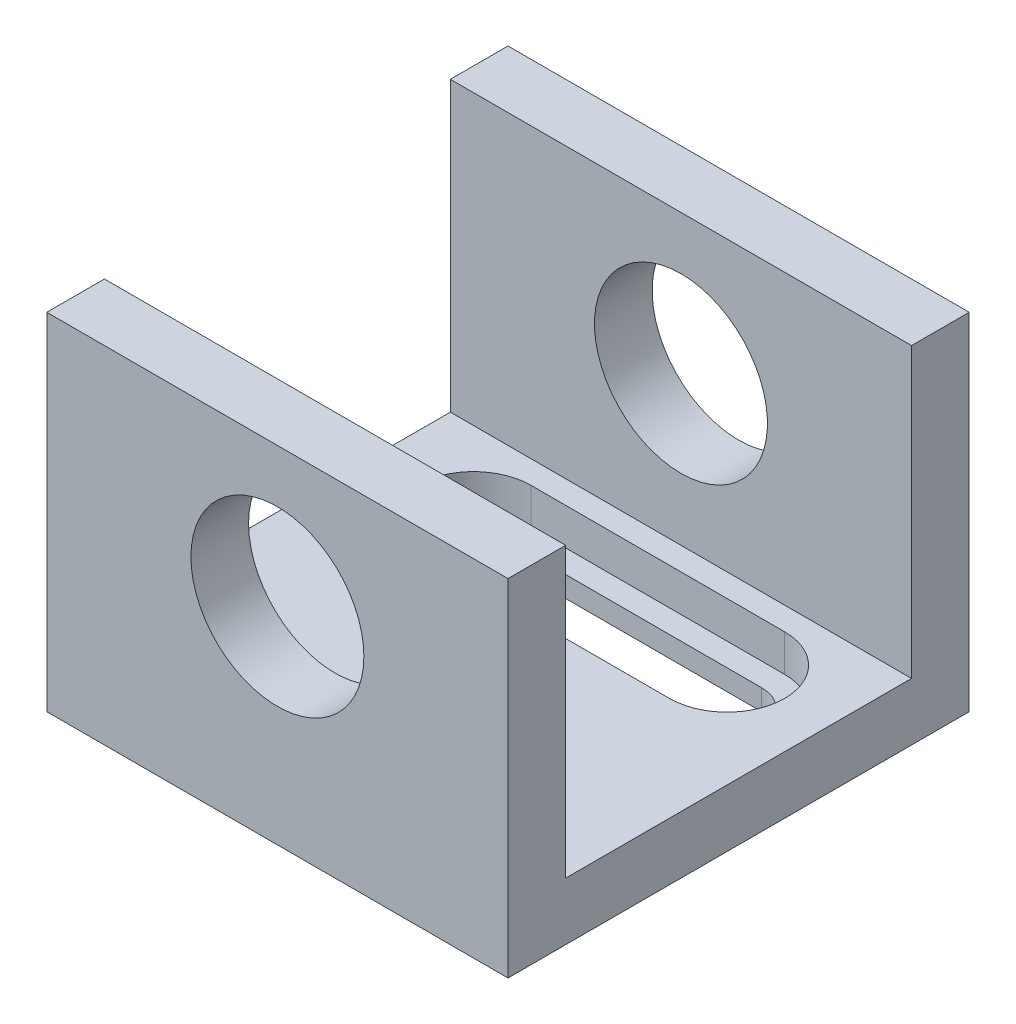
from build123d import *

# Parameters (mm, degrees)
BOSS_EXTRUDE2_DEPTH = 25.4
SKETCH3_R           = 4.7625
CUT_EXTRUDE1_DEPTH  = 36.576
CUT_EXTRUDE2_DEPTH  = 66.04
CUT_EXTRUDE3_DEPTH  = 2.032


with BuildPart() as part:
    # Sketch1 → Boss-Extrude2 (new body)
    with BuildSketch(Plane(origin=(-35.145897579, 0, 0), x_dir=(0, 0, -1), z_dir=(1, 0, 0))):
        Polygon((0, 0), (-19.05, 0), (-22.225, 0), (-22.225, 19.05), (-19.05, 19.05), (-19.05, 3.175), (0, 3.175), (0, 19.05), (3.175, 19.05), (3.175, 0), align=None)
    extrude(amount=BOSS_EXTRUDE2_DEPTH)

    # Sketch3 → Cut-Extrude1 (cut)
    with BuildSketch(Plane(origin=(0, 0, -3.175), x_dir=(-1, 0, 0), z_dir=(0, 0, -1))):
        with Locations((22.445897579, 11.3665)):
            Circle(SKETCH3_R)
    extrude(amount=-CUT_EXTRUDE1_DEPTH, mode=Mode.SUBTRACT)

    # Sketch4 → Cut-Extrude2 (cut)
    with BuildSketch(Plane(origin=(0, 3.175, 0), x_dir=(1, 0, 0), z_dir=(0, 1, 0))):
        with BuildLine():
            Line((-29.430897579, -2.54), (-15.460897579, -2.54))
            ThreePointArc((-15.460897579, -2.54), (-13.555897579, -4.445), (-15.460897579, -6.35))
            Line((-15.460897579, -6.35), (-29.430897579, -6.35))
            ThreePointArc((-29.430897579, -6.35), (-31.335897579, -4.445), (-29.430897579, -2.54))
        make_face()
    extrude(amount=-CUT_EXTRUDE2_DEPTH, mode=Mode.SUBTRACT)

    # Sketch7 → Cut-Extrude3 (cut)
    with BuildSketch(Plane(origin=(0, 3.175, 0), x_dir=(1, 0, 0), z_dir=(0, 1, 0))):
        with BuildLine():
            Line((-29.430897579, -1.27), (-15.460897579, -1.27))
            ThreePointArc((-15.460897579, -1.27), (-12.285897579, -4.445), (-15.460897579, -7.62))
            Line((-15.460897579, -7.62), (-29.430897579, -7.62))
            ThreePointArc((-29.430897579, -7.62), (-32.605897579, -4.445), (-29.430897579, -1.27))
        make_face()
    extrude(amount=-CUT_EXTRUDE3_DEPTH, mode=Mode.SUBTRACT)


solid = part.part
